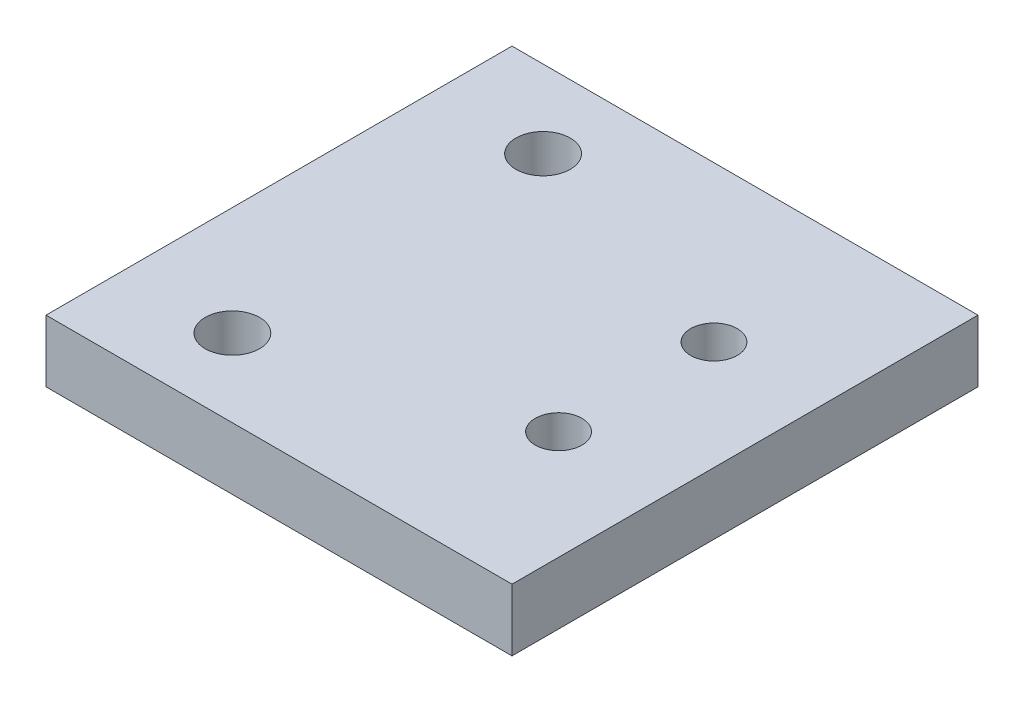
from build123d import *

# Parameters (mm, degrees)
SKETCH_1_W      = 30
SKETCH_1_H      = 30
SKETCH_1_R      = 1.75
SKETCH_1_R_2    = 1.5
EXTRUDE_1_DEPTH = 4


with BuildPart() as part:
    # 草图1 → 凸台-拉伸1 (new body)
    with BuildSketch(Plane(origin=(0, 0, 0), x_dir=(1, 0, 0), z_dir=(0, 1, 0))):
        with Locations((15, 15)):
            Rectangle(SKETCH_1_W, SKETCH_1_H)
        with Locations(Location((7, 25, 0), (0, 0, 270))):
            Circle(SKETCH_1_R, mode=Mode.SUBTRACT)
        with Locations(Location((7, 5, 0), (0, 0, 270))):
            Circle(SKETCH_1_R, mode=Mode.SUBTRACT)
        with Locations(Location((23, 20, 0), (0, 0, 270))):
            Circle(SKETCH_1_R_2, mode=Mode.SUBTRACT)
        with Locations(Location((23, 10, 0), (0, 0, 270))):
            Circle(SKETCH_1_R_2, mode=Mode.SUBTRACT)
    extrude(amount=EXTRUDE_1_DEPTH)


solid = part.part
